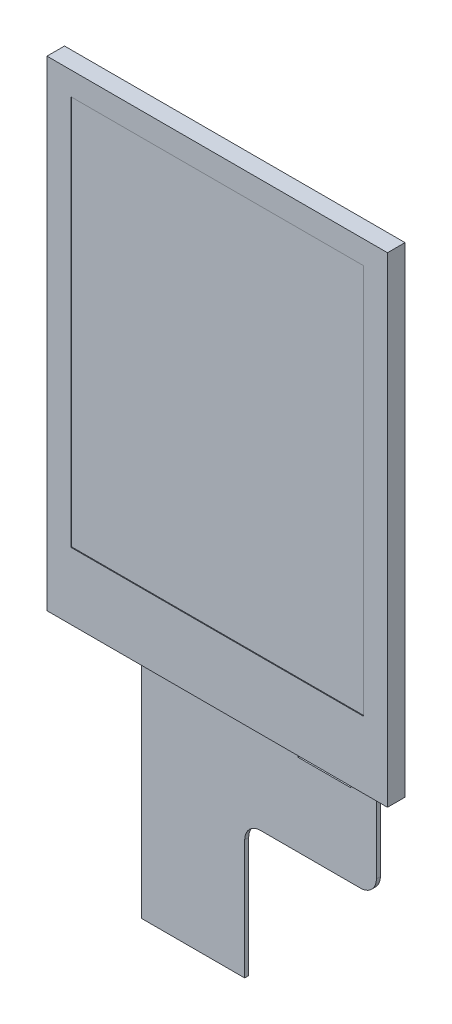
from build123d import *

# Parameters (mm, degrees)
SKETCH_1_W          = 42.72
SKETCH_1_H          = 60.26
EXTRUDE_1_DEPTH     = 2.2
SKETCH_2_W          = 36.72
SKETCH_2_H          = 48.96
CUT_EXTRUDE_1_DEPTH = 0.1
SKETCH_3_W          = 29.464595321
SKETCH_3_H          = 0.5
EXTRUDE_1004_DEPTH  = 29
SKETCH_4_W          = 16.518374104
SKETCH_4_H          = 17.022875601
SKETCH_4_W_2        = 6.622613049
SKETCH_4_H_2        = 1.675281879
CUT_EXTRUDE_2_DEPTH = 44.9
FILLET_1_R          = 2


with BuildPart() as part:
    # 草图1 → 凸台-拉伸1 (new body)
    with BuildSketch(Plane.XY):
        Rectangle(SKETCH_1_W, SKETCH_1_H)
    extrude(amount=EXTRUDE_1_DEPTH)

    # 草图2 → 切除-拉伸1 (cut)
    with BuildSketch(Plane.XY.offset(2.2)):
        with Locations((0, 2.74)):
            Rectangle(SKETCH_2_W, SKETCH_2_H)
    extrude(amount=-CUT_EXTRUDE_1_DEPTH, mode=Mode.SUBTRACT)

    # 草图3 → Extrude 1004 (add)
    with BuildSketch(Plane.XZ.offset(30.13)):
        with Locations((3.732297661, 0.45)):
            Rectangle(SKETCH_3_W, SKETCH_3_H)
    extrude(amount=EXTRUDE_1004_DEPTH)

    # 草图4 → 切除-拉伸2 (cut)
    with BuildSketch(Plane.XY.offset(0.7)):
        with Locations((10.205408269, -50.6185622)):
            Rectangle(SKETCH_4_W, SKETCH_4_H)
        with Locations((11.972121528, -30.96764094)):
            Rectangle(SKETCH_4_W_2, SKETCH_4_H_2)
    extrude(amount=-CUT_EXTRUDE_2_DEPTH, mode=Mode.SUBTRACT)

    # 圆角1
    fillet_1_edges = [part.edges().sort_by_distance(p)[0] for p in [
        (18.464595321, -42.107124399, 0.45),
        (1.946221217, -42.107124399, 0.45),
    ]]
    fillet(fillet_1_edges, radius=FILLET_1_R)


solid = part.part
